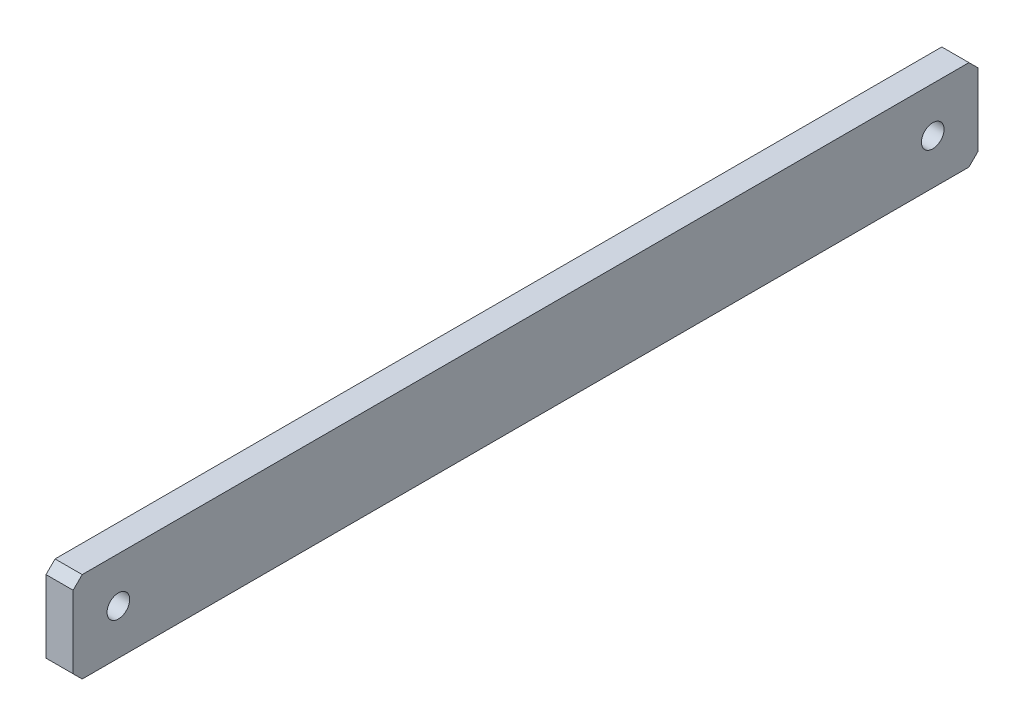
from build123d import *

# Parameters (mm, degrees)
SKETCH_1_W          = 100
SKETCH_1_H          = 10
EXTRUDE_1_DEPTH     = 3
SKETCH_2_R          = 1.25
CUT_EXTRUDE_1_DEPTH = 51.338851795
CHAMFER_1_SIZE      = 1


with BuildPart() as part:
    # 草图1 → 凸台-拉伸1 (new body)
    with BuildSketch(Plane(origin=(0, 0, 0), x_dir=(0, 0, -1), z_dir=(1, 0, 0))):
        Rectangle(SKETCH_1_W, SKETCH_1_H)
    extrude(amount=EXTRUDE_1_DEPTH)

    # 草图2 → 切除-拉伸1 (cut, through all)
    with BuildSketch(Plane(origin=(3, 0, 0), x_dir=(0, 0, -1), z_dir=(1, 0, 0))):
        with Locations((-45, 0)):
            Circle(SKETCH_2_R)
        with Locations((45, 0)):
            Circle(SKETCH_2_R)
    extrude(amount=-CUT_EXTRUDE_1_DEPTH, mode=Mode.SUBTRACT)

    # 倒角1
    chamfer_1_edges = [part.edges().sort_by_distance(p)[0] for p in [
        (1.5, 5, 50),
        (1.5, 5, -50),
        (1.5, -5, -50),
        (1.5, -5, 50),
    ]]
    chamfer(chamfer_1_edges, length=CHAMFER_1_SIZE)


solid = part.part
